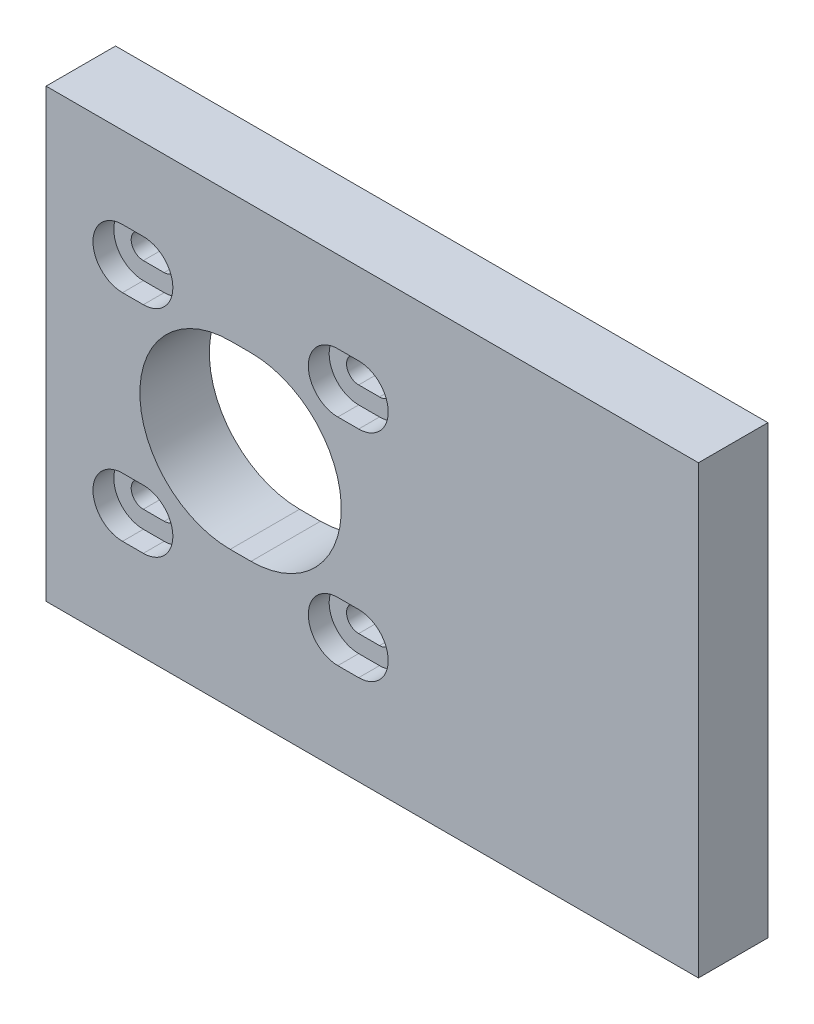
from build123d import *

# Parameters (mm, degrees)
SKETCH1_W           = 93.911938319
SKETCH1_H           = 64.237222829
BOSS_EXTRUDE1_DEPTH = 10
CUT_EXTRUDE1_DEPTH  = 20
CUT_EXTRUDE2_DEPTH  = 3


with BuildPart() as part:
    # Sketch1 → Boss-Extrude1 (new body)
    with BuildSketch(Plane.XY):
        with Locations((-3.99305407, -0.113373268)):
            Rectangle(SKETCH1_W, SKETCH1_H)
    extrude(amount=BOSS_EXTRUDE1_DEPTH)

    # Sketch2 → Cut-Extrude1 (cut)
    with BuildSketch(Plane.XY.offset(10)):
        with BuildLine():
            Line((-39.949023229, 17.755238146), (-36.949023229, 17.755238146))
            ThreePointArc((-36.949023229, 17.755238146), (-35.199023229, 16.005238146), (-36.949023229, 14.255238146))
            Line((-36.949023229, 14.255238146), (-39.949023229, 14.255238146))
            ThreePointArc((-39.949023229, 14.255238146), (-41.699023229, 16.005238146), (-39.949023229, 17.755238146))
        make_face()
        with BuildLine():
            Line((-8.949023229, 17.755238146), (-5.949023229, 17.755238146))
            ThreePointArc((-5.949023229, 17.755238146), (-4.199023229, 16.005238146), (-5.949023229, 14.255238146))
            Line((-5.949023229, 14.255238146), (-8.949023229, 14.255238146))
            ThreePointArc((-8.949023229, 14.255238146), (-10.699023229, 16.005238146), (-8.949023229, 17.755238146))
        make_face()
        with BuildLine():
            Line((-8.949023229, -13.244761854), (-5.949023229, -13.244761854))
            ThreePointArc((-5.949023229, -13.244761854), (-4.199023229, -14.994761854), (-5.949023229, -16.744761854))
            Line((-5.949023229, -16.744761854), (-8.949023229, -16.744761854))
            ThreePointArc((-8.949023229, -16.744761854), (-10.699023229, -14.994761854), (-8.949023229, -13.244761854))
        make_face()
        with BuildLine():
            Line((-39.949023229, -13.244761854), (-36.949023229, -13.244761854))
            ThreePointArc((-36.949023229, -13.244761854), (-35.199023229, -14.994761854), (-36.949023229, -16.744761854))
            Line((-36.949023229, -16.744761854), (-39.949023229, -16.744761854))
            ThreePointArc((-39.949023229, -16.744761854), (-41.699023229, -14.994761854), (-39.949023229, -13.244761854))
        make_face()
        with BuildLine():
            Line((-24.449023229, 13.505238146), (-21.449023229, 13.505238146))
            ThreePointArc((-21.449023229, 13.505238146), (-8.449023229, 0.505238146), (-21.449023229, -12.494761854))
            Line((-21.449023229, -12.494761854), (-24.449023229, -12.494761854))
            ThreePointArc((-24.449023229, -12.494761854), (-37.449023229, 0.505238146), (-24.449023229, 13.505238146))
        make_face()
    extrude(amount=-CUT_EXTRUDE1_DEPTH, mode=Mode.SUBTRACT)

    # Sketch3 → Cut-Extrude2 (cut)
    with BuildSketch(Plane.XY.offset(10)):
        with BuildLine():
            Line((-36.949023229, 20.255238146), (-39.949023229, 20.255238146))
            ThreePointArc((-39.949023229, 20.255238146), (-44.199023229, 16.005238146), (-39.949023229, 11.755238146))
            Line((-39.949023229, 11.755238146), (-36.949023229, 11.755238146))
            ThreePointArc((-36.949023229, 11.755238146), (-32.699023229, 16.005238146), (-36.949023229, 20.255238146))
        make_face()
        with BuildLine():
            Line((-5.949023229, 20.255238146), (-8.949023229, 20.255238146))
            ThreePointArc((-8.949023229, 20.255238146), (-13.199023229, 16.005238146), (-8.949023229, 11.755238146))
            Line((-8.949023229, 11.755238146), (-5.949023229, 11.755238146))
            ThreePointArc((-5.949023229, 11.755238146), (-1.699023229, 16.005238146), (-5.949023229, 20.255238146))
        make_face()
        with BuildLine():
            Line((-5.949023229, -10.744761854), (-8.949023229, -10.744761854))
            ThreePointArc((-8.949023229, -10.744761854), (-13.199023229, -14.994761854), (-8.949023229, -19.244761854))
            Line((-8.949023229, -19.244761854), (-5.949023229, -19.244761854))
            ThreePointArc((-5.949023229, -19.244761854), (-1.699023229, -14.994761854), (-5.949023229, -10.744761854))
        make_face()
        with BuildLine():
            Line((-39.949023229, -19.244761854), (-36.949023229, -19.244761854))
            ThreePointArc((-36.949023229, -19.244761854), (-32.699023229, -14.994761854), (-36.949023229, -10.744761854))
            Line((-36.949023229, -10.744761854), (-39.949023229, -10.744761854))
            ThreePointArc((-39.949023229, -10.744761854), (-44.199023229, -14.994761854), (-39.949023229, -19.244761854))
        make_face()
    extrude(amount=-CUT_EXTRUDE2_DEPTH, mode=Mode.SUBTRACT)


solid = part.part
